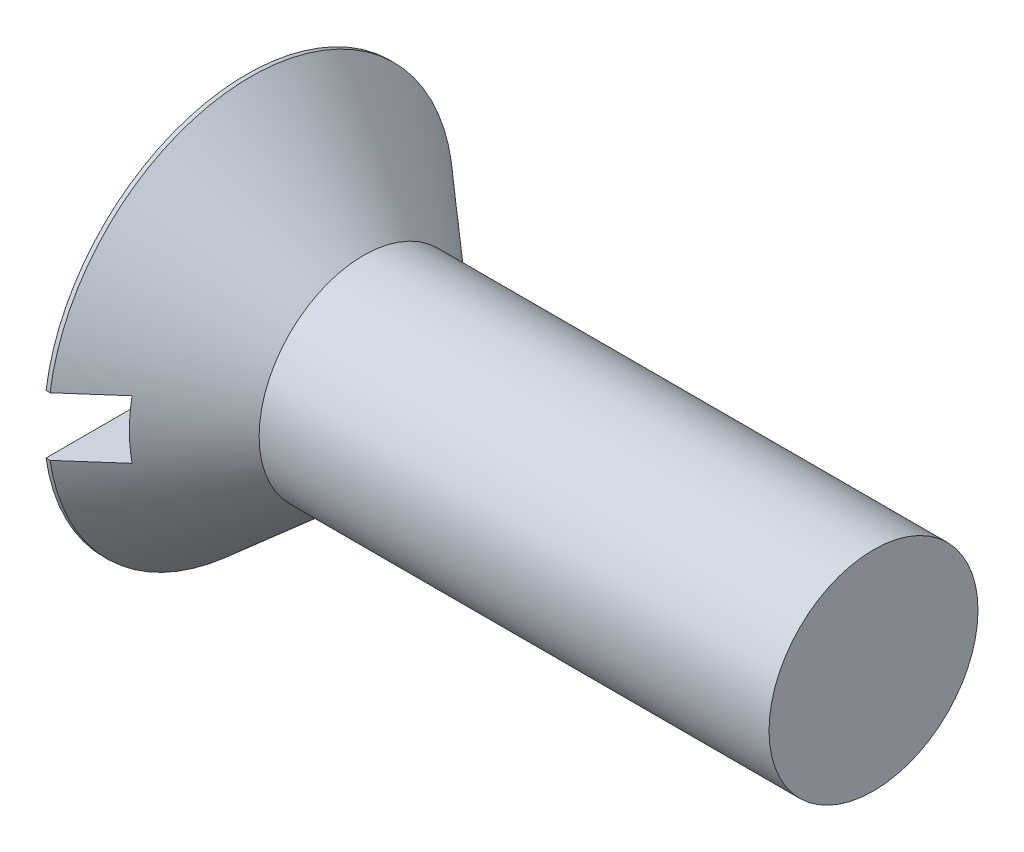
from build123d import *

# Parameters (mm, degrees)
SKETCH6_W  = 12.319
SKETCH6_H  = 1.778
SLOT_DEPTH = 1.4478


with BuildPart() as part:
    # BodySke → Base-Revolve (revolve)
    with BuildSketch(Plane.XY, mode=Mode.PRIVATE) as base_revolve_sk:
        Polygon((0, 0), (0, 6.1595), (0.122725489, 6.1595), (3.556, 3.175), (19.05, 3.175), (19.05, 0), align=None)
    revolve(base_revolve_sk.sketch.rotate(Axis((-6.35, 0, 0), (1, 0, 0)), 90), axis=Axis((-6.35, 0, 0), (1, 0, 0)))

    # Sketch6 → Slot (cut)
    with BuildSketch(Plane.ZY):
        Rectangle(SKETCH6_W, SKETCH6_H)
    extrude(amount=-SLOT_DEPTH, mode=Mode.SUBTRACT)


solid = part.part
